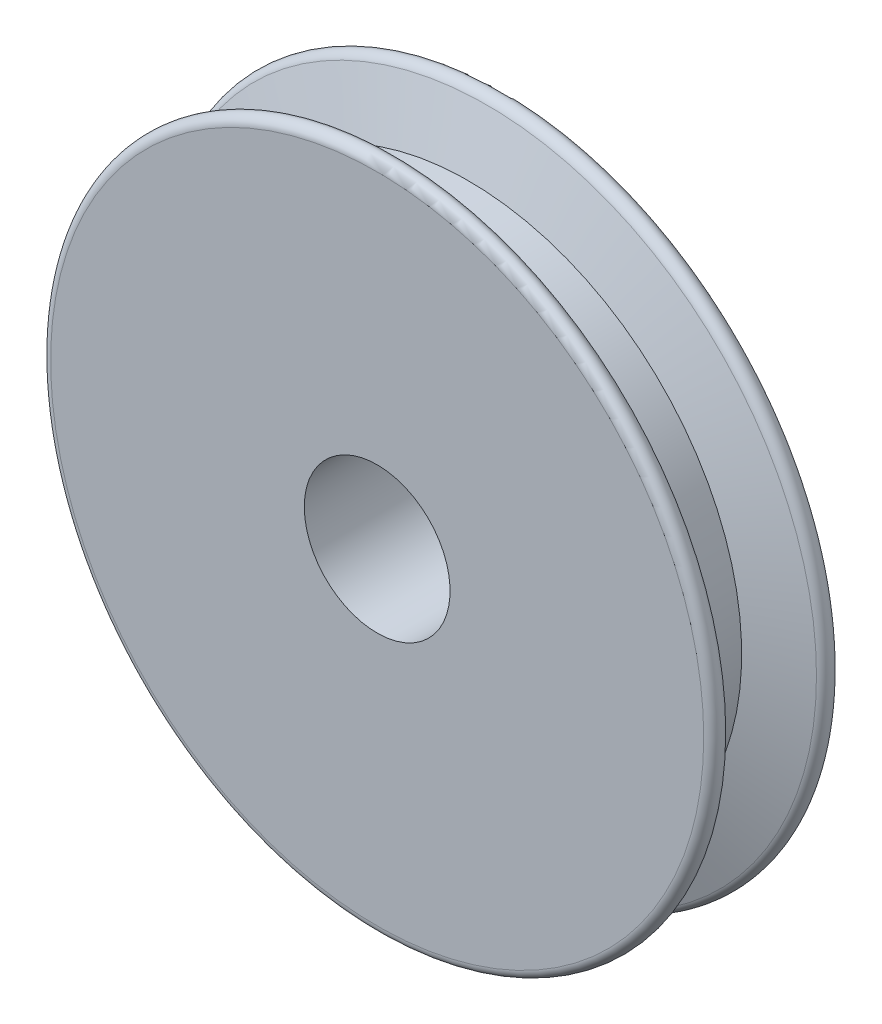
from build123d import *

# Parameters (mm, degrees)
FILLET2_R = 1.27


with BuildPart() as part:
    # Sketch1 → Revolve1 (revolve)
    with BuildSketch(Plane.YZ, mode=Mode.PRIVATE) as revolve1_sk:
        Polygon((10.16, 0), (10.16, 17.78), (53.34, 17.78), (38.1, 12.7), (38.1, 5.08), (53.357021735, 0), align=None)
    revolve(revolve1_sk.sketch.rotate(Axis((0, 0, 0), (0, 0, 1)), 90), axis=Axis((0, 0, 0), (0, 0, 1)))

    # Fillet2
    fillet2_edges = [part.edges().sort_by_distance(p)[0] for p in [
        (53.34, 0, 17.78),
        (53.357021735, 0, 0),
    ]]
    fillet(fillet2_edges, radius=FILLET2_R)


solid = part.part
